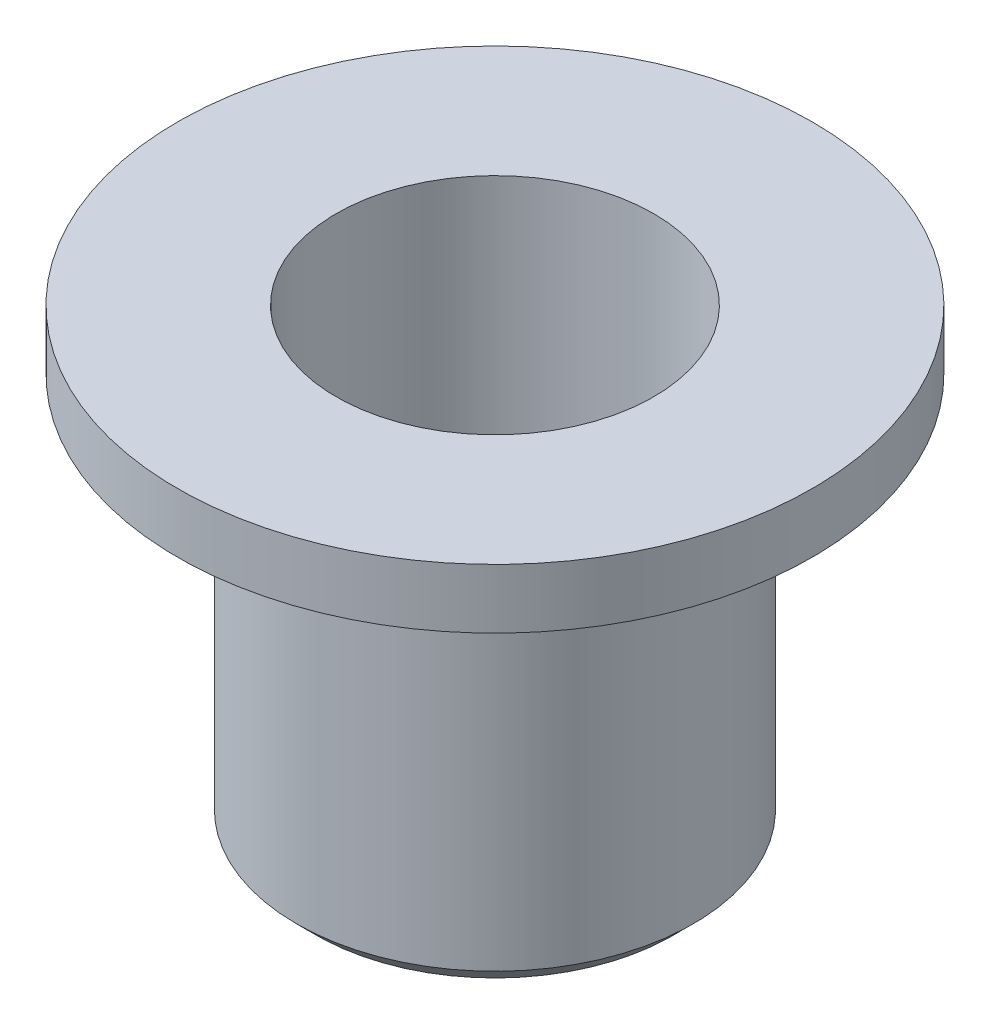
from build123d import *


with BuildPart() as part:
    # Esquisse1 → Base-Révolution (revolve)
    with BuildSketch(Plane.XY, mode=Mode.PRIVATE) as base_r_volution_sk:
        Polygon((4, 0), (4.5, 0), (5, 0.5), (5, 10), (8, 10), (8, 11.5), (4, 11.5), align=None)
    revolve(base_r_volution_sk.sketch.rotate(Axis((0, 0, 0), (0, 1, 0)), 90), axis=Axis((0, 0, 0), (0, 1, 0)))


solid = part.part
